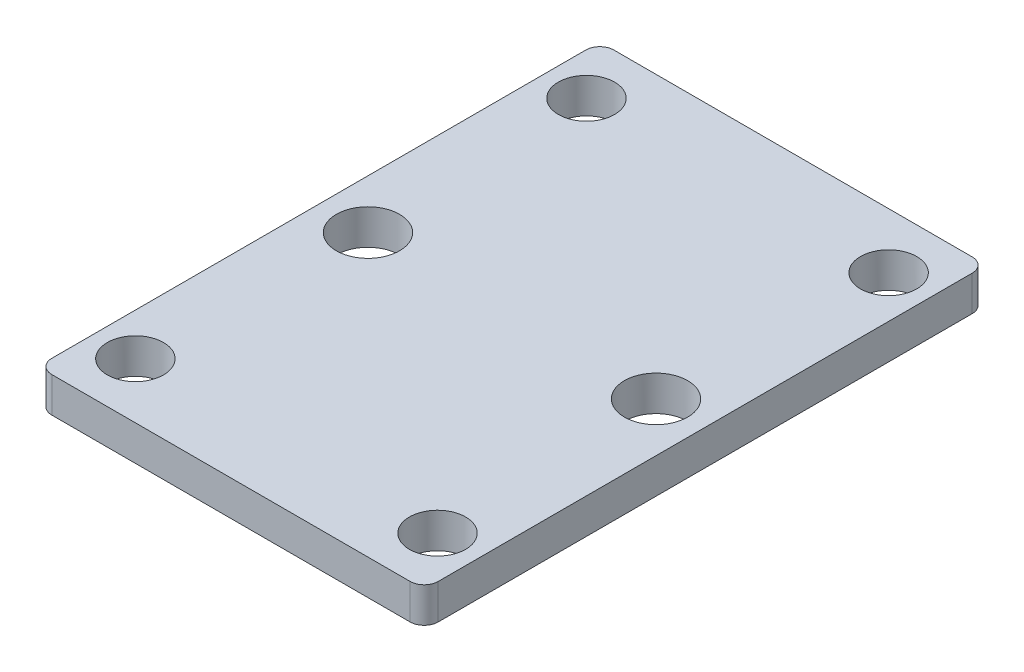
from build123d import *

# Parameters (mm, degrees)
SALIENTE_EXTRUIR1_DEPTH = 5
CROQUIS2_R              = 4.5
CROQUIS2_R_2            = 4
CORTAR_EXTRUIR1_DEPTH   = 10


with BuildPart() as part:
    # Croquis1 → Saliente-Extruir1 (new body)
    with BuildSketch(Plane(origin=(0, 0, 0), x_dir=(1, 0, 0), z_dir=(0, 1, 0))):
        with BuildLine():
            Line((-27.5, -38), (-27.5, 38))
            ThreePointArc((-27.5, 38), (-26.914213562, 39.414213562), (-25.5, 40))
            Line((-25.5, 40), (25.5, 40))
            ThreePointArc((25.5, 40), (26.914213562, 39.414213562), (27.5, 38))
            Line((27.5, 38), (27.5, -38))
            ThreePointArc((27.5, -38), (26.914213562, -39.414213562), (25.5, -40))
            Line((25.5, -40), (-25.5, -40))
            ThreePointArc((-25.5, -40), (-26.914213562, -39.414213562), (-27.5, -38))
        make_face()
    extrude(amount=SALIENTE_EXTRUIR1_DEPTH)

    # Croquis2 → Cortar-Extruir1 (cut)
    with BuildSketch(Plane(origin=(0, 5, 0), x_dir=(1, 0, 0), z_dir=(0, 1, 0))):
        with Locations(Location((-20.5, 0, 0), (0, 0, 270))):
            Circle(CROQUIS2_R)
        with Locations(Location((20.5, 0, 0), (0, 0, 270))):
            Circle(CROQUIS2_R)
        with Locations(Location((-21.5, 32.1, 0), (0, 0, 270))):
            Circle(CROQUIS2_R_2)
        with Locations(Location((-21.5, -32.1, 0), (0, 0, 270))):
            Circle(CROQUIS2_R_2)
        with Locations(Location((21.5, 32.1, 0), (0, 0, 270))):
            Circle(CROQUIS2_R_2)
        with Locations(Location((21.5, -32.1, 0), (0, 0, 270))):
            Circle(CROQUIS2_R_2)
    extrude(amount=-CORTAR_EXTRUIR1_DEPTH, mode=Mode.SUBTRACT)


solid = part.part
